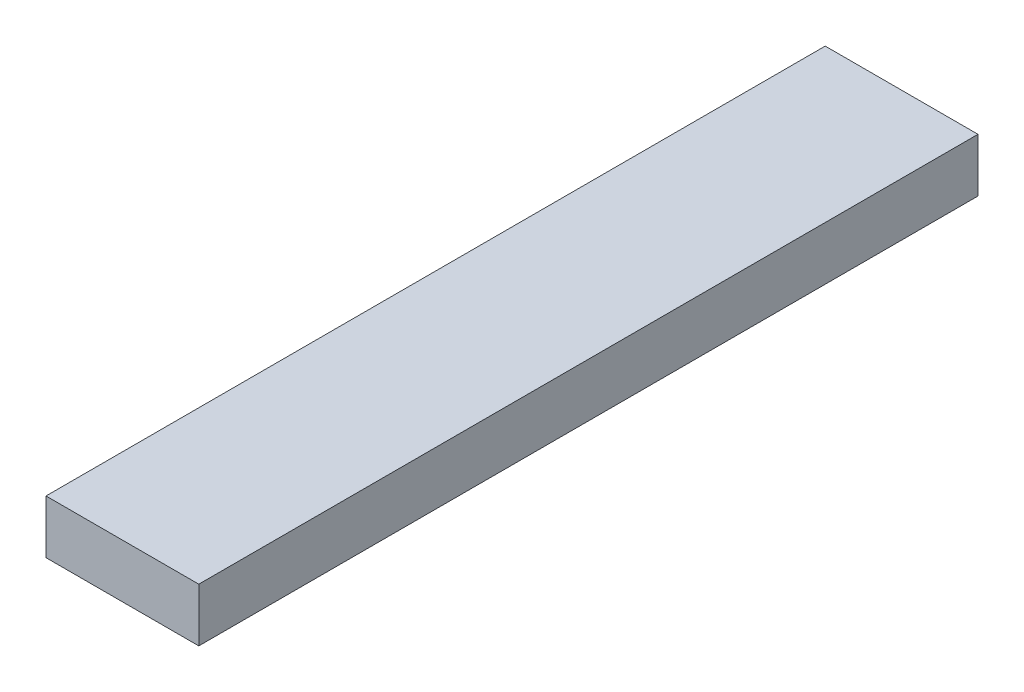
from build123d import *

# Parameters (mm, degrees)
SKETCH_1_W      = 100
SKETCH_1_H      = 35
EXTRUDE_1_DEPTH = 510


with BuildPart() as part:
    # Эскиз1 → Бобышка-Вытянуть1 (new body)
    with BuildSketch(Plane.XY):
        with Locations((50, 17.5)):
            Rectangle(SKETCH_1_W, SKETCH_1_H)
    extrude(amount=-EXTRUDE_1_DEPTH)


solid = part.part
